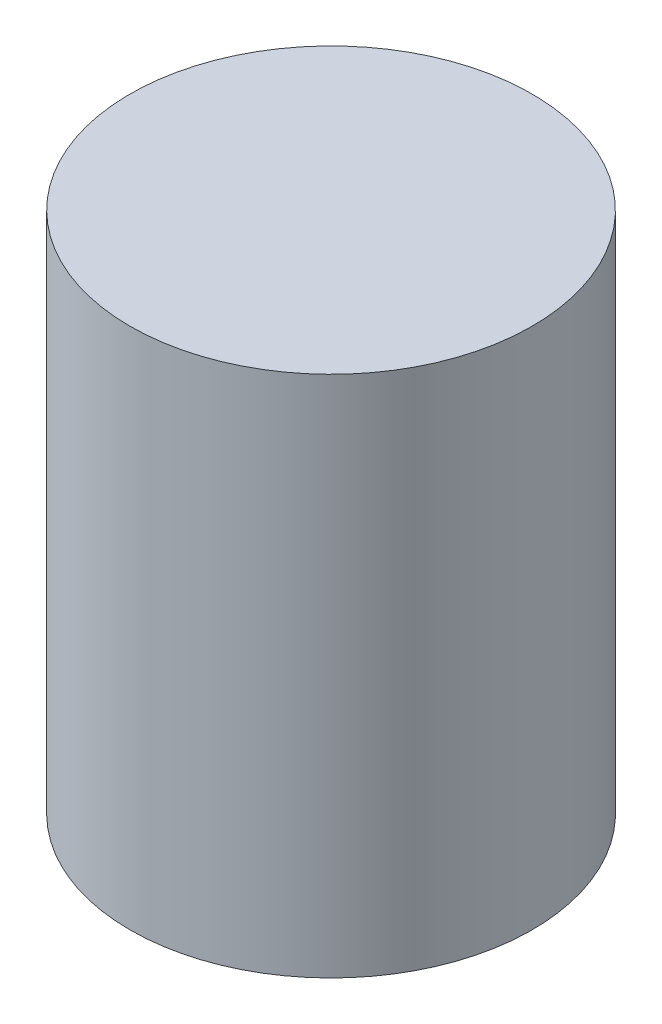
from build123d import *

# Parameters (mm, degrees)
SKETCH1_R           = 15
BOSS_EXTRUDE1_DEPTH = 39


with BuildPart() as part:
    # Sketch1 → Boss-Extrude1 (new body)
    with BuildSketch(Plane(origin=(0, 34.901980518, 0), x_dir=(1, 0, 0), z_dir=(0, 1, 0))):
        with Locations(Location((-13.679845786, -47.798220112, 0), (0, 0, 270))):
            Circle(SKETCH1_R)
    extrude(amount=-BOSS_EXTRUDE1_DEPTH)


solid = part.part
